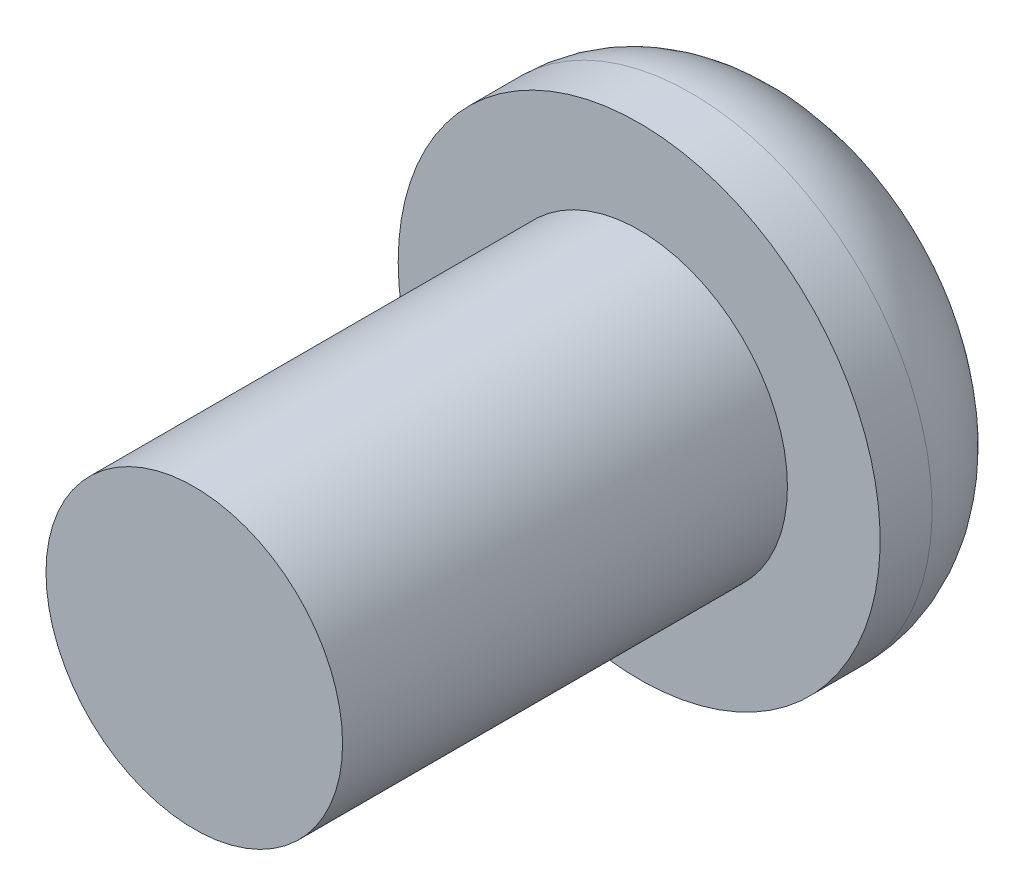
from build123d import *

# Parameters (mm, degrees)
SKETCH_1_R      = 2
EXTRUDE_1_DEPTH = 6
SKETCH_2_R      = 3.25
EXTRUDE_2_DEPTH = 2.2
FILLET_1_R      = 1.5


with BuildPart() as part:
    # 草图1 → 凸台-拉伸1 (new body)
    with BuildSketch(Plane.XY):
        Circle(SKETCH_1_R)
    extrude(amount=EXTRUDE_1_DEPTH)

    # 草图2 → 凸台-拉伸2 (add)
    with BuildSketch(Plane(origin=(0, 0, 0), x_dir=(-1, 0, 0), z_dir=(0, 0, -1))):
        Circle(SKETCH_2_R)
    extrude(amount=EXTRUDE_2_DEPTH)

    # 圆角1
    fillet_1_edges = [part.edges().sort_by_distance(p)[0] for p in [
        (3.25, 0, -2.2),
    ]]
    fillet(fillet_1_edges, radius=FILLET_1_R)


solid = part.part
